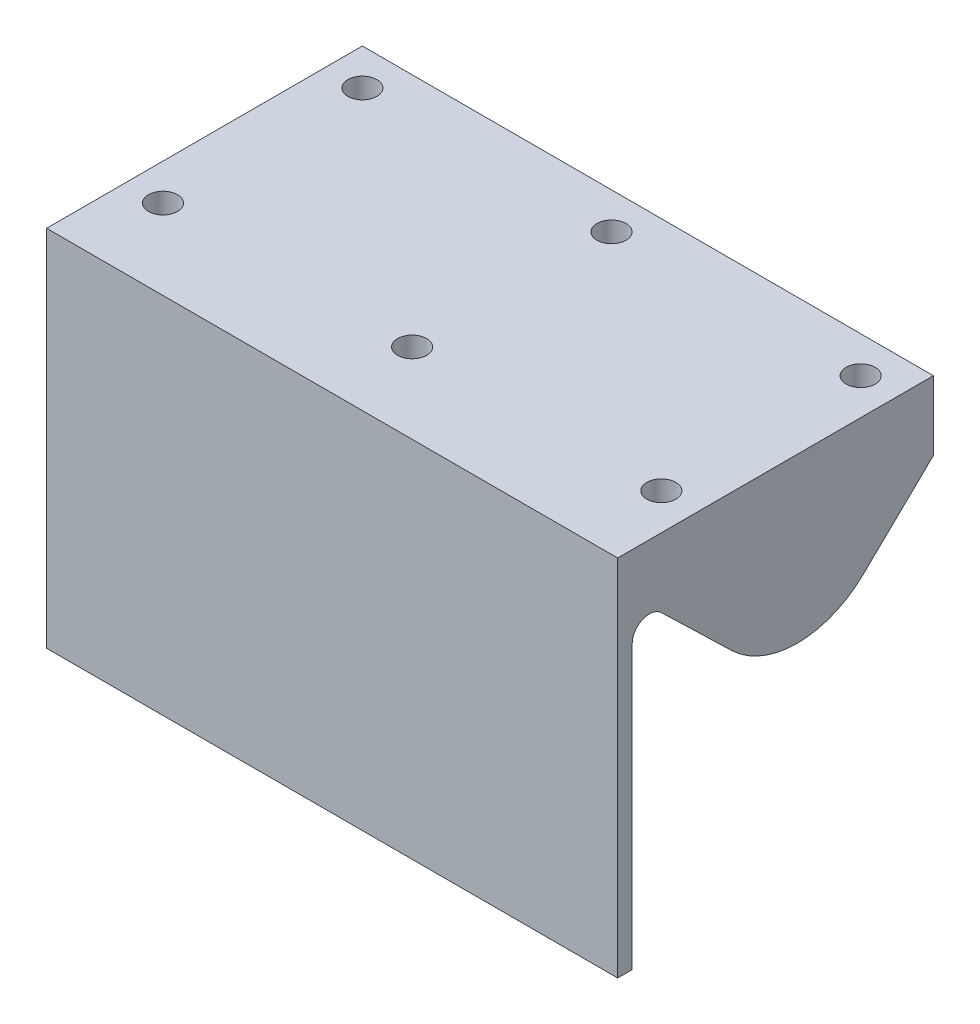
from build123d import *

# Parameters (mm, degrees)
SKETCH1_W           = 78.5
SKETCH1_H           = 37.4
BOSS_EXTRUDE1_DEPTH = 9.5
SKETCH6_R           = 2
CUT_EXTRUDE1_DEPTH  = 6.5
BOSS_EXTRUDE2_DEPTH = 4
SKETCH9_W           = 13
SKETCH9_H           = 5.5
CUT_EXTRUDE3_DEPTH  = 56.75233179
BOSS_EXTRUDE3_REACH = 83.737
BOSS_EXTRUDE4_START = -4
BOSS_EXTRUDE4_DEPTH = 4
BOSS_EXTRUDE5_DEPTH = 4


with BuildPart() as part:
    # Sketch1 → Boss-Extrude1 (new body)
    with BuildSketch(Plane(origin=(0, 0, 0), x_dir=(1, 0, 0), z_dir=(0, 1, 0))):
        Rectangle(SKETCH1_W, SKETCH1_H)
    extrude(amount=BOSS_EXTRUDE1_DEPTH)

    # Sketch6 → Cut-Extrude1 (cut)
    with BuildSketch(Plane(origin=(0, 9.5, 0), x_dir=(1, 0, 0), z_dir=(0, 1, 0))):
        with Locations(Location((-34.25, 13.7, 0), (0, 0, 270))):
            Circle(SKETCH6_R)
        with Locations(Location((0, 13.7, 0), (0, 0, 270))):
            Circle(SKETCH6_R)
        with Locations(Location((34.25, 13.7, 0), (0, 0, 270))):
            Circle(SKETCH6_R)
        with Locations(Location((34.25, -13.7, 0), (0, 0, 270))):
            Circle(SKETCH6_R)
        with Locations(Location((0, -13.7, 0), (0, 0, 270))):
            Circle(SKETCH6_R)
        with Locations(Location((-34.25, -13.7, 0), (0, 0, 270))):
            Circle(SKETCH6_R)
    extrude(amount=-CUT_EXTRUDE1_DEPTH, mode=Mode.SUBTRACT)

    # Sketch7 → Boss-Extrude2 (add)
    with BuildSketch(Plane.ZY.offset(39.25)):
        with BuildLine():
            Line((-18.7, 0), (-9.037433155, -9.344774046))
            ThreePointArc((-9.037433155, -9.344774046), (0, -13), (9.037433155, -9.344774046))
            Line((9.037433155, -9.344774046), (18.7, 0))
            Line((18.7, 0), (-18.7, 0))
        make_face()
    boss_extrude2 = extrude(amount=-BOSS_EXTRUDE2_DEPTH)

    # Mirror1: Boss-Extrude2 across plane
    add(boss_extrude2.mirror(Plane(origin=(0, 0, 0), x_dir=(0, 0, 1), z_dir=(1, 0, 0))))

    # Sketch9 → Cut-Extrude3 (cut, through all)
    with BuildSketch(Plane(origin=(0, 0, -18.7), x_dir=(-1, 0, 0), z_dir=(0, 0, -1))):
        with Locations((22.75, 4.75)):
            Rectangle(SKETCH9_W, SKETCH9_H)
        with Locations((-22.75, 4.75)):
            Rectangle(SKETCH9_W, SKETCH9_H)
    extrude(amount=-CUT_EXTRUDE3_DEPTH, mode=Mode.SUBTRACT)

    # Boss-Extrude3: up to this face of the body (flat: up to its plane)
    boss_extrude3_end = Plane(part.part.faces().sort_by_distance((-39.25, 0.189608499, 0))[0])
    # Sketch10 → Boss-Extrude3 (add, up to the picked face)
    with BuildSketch(Plane(origin=(39.25, 0, 0), x_dir=(0, 0, -1), z_dir=(1, 0, 0)), mode=Mode.PRIVATE) as boss_extrude3_sk1:
        with BuildLine():
            Line((-22.7, -40.5), (-24.7, -40.5))
            Line((-24.7, -40.5), (-24.7, 9.5))
            Line((-24.7, 9.5), (-18.7, 9.5))
            Line((-18.7, 9.5), (-18.7, 7.5))
            ThreePointArc((-18.7, 7.5), (-21.528427125, 6.328427125), (-22.7, 3.5))
            Line((-22.7, 3.5), (-22.7, -40.5))
        make_face()
    boss_extrude3_tool1 = split(extrude(boss_extrude3_sk1.sketch, amount=-BOSS_EXTRUDE3_REACH, mode=Mode.PRIVATE), bisect_by=boss_extrude3_end, keep=Keep.BOTH, mode=Mode.PRIVATE)
    add(boss_extrude3_tool1.solids().sort_by(Axis((39.25, -13.095828, 23.426281), (-1, 0, 0)))[0])

    # Sketch11 → Boss-Extrude4 (add)
    with BuildSketch(Plane.ZY.offset(39.25).offset(BOSS_EXTRUDE4_START)):
        with BuildLine():
            Line((18.7, 7.5), (18.7, 0))
            ThreePointArc((18.7, 0), (21.261557408, 0.476218058), (22.7, -1.696163792))
            Line((22.7, -1.696163792), (22.7, 3.5))
            ThreePointArc((22.7, 3.5), (21.528427125, 6.328427125), (18.7, 7.5))
        make_face()
    extrude(amount=BOSS_EXTRUDE4_DEPTH)

    # Sketch12 → Boss-Extrude5 (add)
    with BuildSketch(Plane(origin=(39.25, 0, 0), x_dir=(0, 0, -1), z_dir=(1, 0, 0))):
        with BuildLine():
            Line((-18.7, 0), (-18.7, 7.5))
            ThreePointArc((-18.7, 7.5), (-21.528427125, 6.328427125), (-22.7, 3.5))
            Line((-22.7, 3.5), (-22.7, -1.696163792))
            ThreePointArc((-22.7, -1.696163792), (-21.261557408, 0.476218058), (-18.7, 0))
        make_face()
    extrude(amount=-BOSS_EXTRUDE5_DEPTH)


solid = part.part
